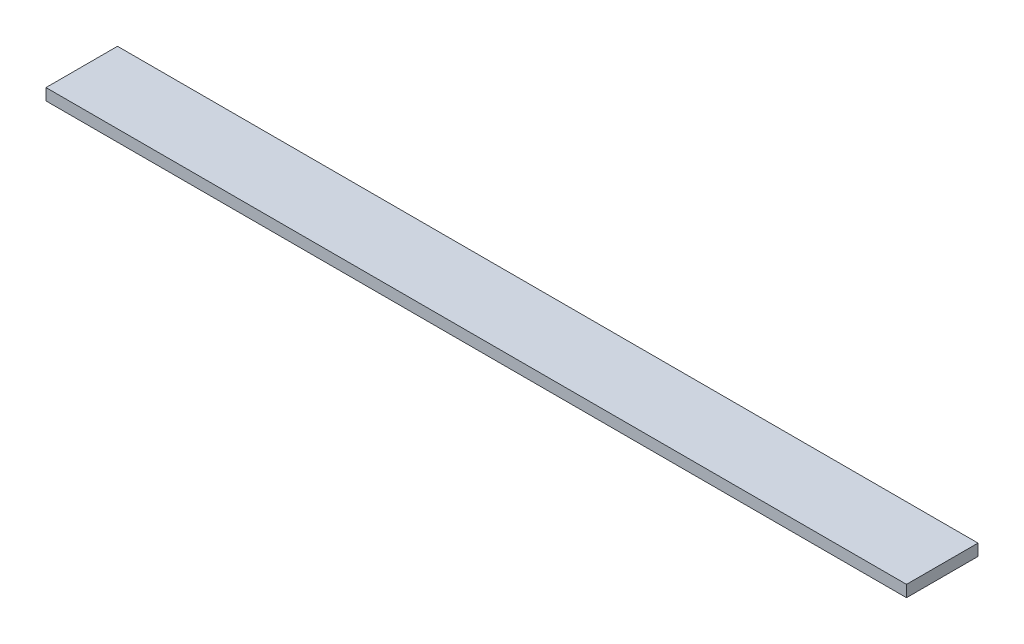
from build123d import *

# Parameters (mm, degrees)
SKETCH1_W           = 2827.3375
SKETCH1_H           = 234.95
BOSS_EXTRUDE1_DEPTH = 38.1


with BuildPart() as part:
    # Sketch1 → Boss-Extrude1 (new body)
    with BuildSketch(Plane(origin=(0, 0, 0), x_dir=(1, 0, 0), z_dir=(0, 1, 0))):
        with Locations((692.494836957, 304.583695652)):
            Rectangle(SKETCH1_W, SKETCH1_H)
    extrude(amount=BOSS_EXTRUDE1_DEPTH)


solid = part.part
